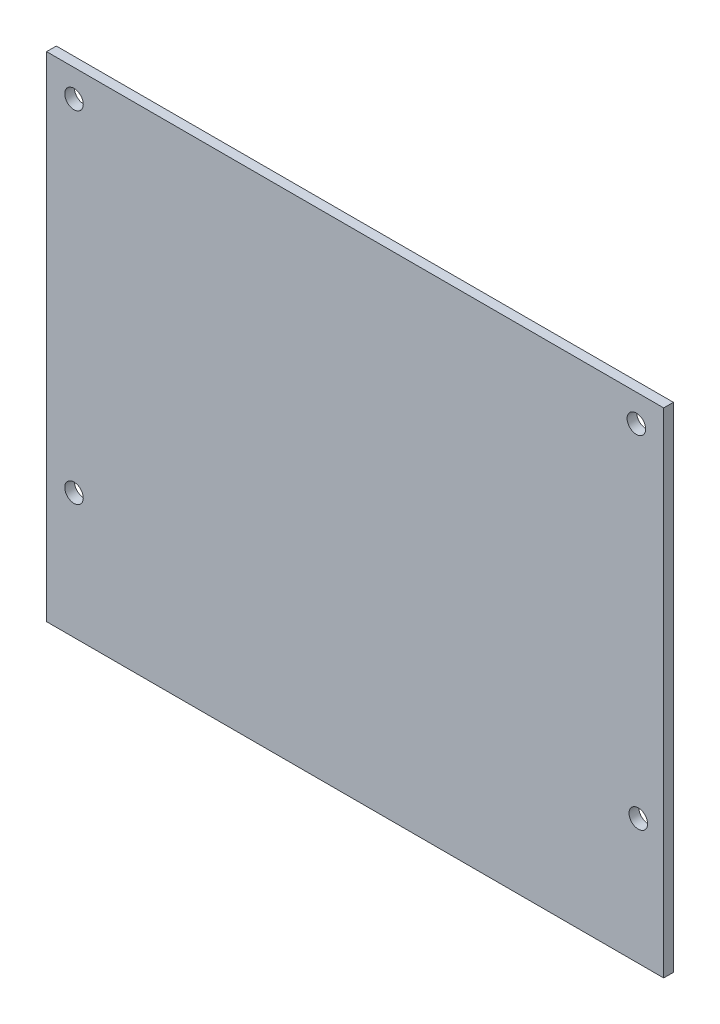
from build123d import *

# Parameters (mm, degrees)
MODEL_W             = 100.0000032
MODEL_H             = 79.9999924
BOSS_EXTRUDE1_DEPTH = 1.5748
SKETCH1_R           = 1.499997
CUT_EXTRUDE1_DEPTH  = 129.072164888


with BuildPart() as part:
    # Model → Boss-Extrude1 (new body)
    with BuildSketch(Plane.XY):
        with Locations((50.0000016, 39.9999962)):
            Rectangle(MODEL_W, MODEL_H)
    extrude(amount=-BOSS_EXTRUDE1_DEPTH)

    # Sketch1 → Cut-Extrude1 (cut, through all)
    with BuildSketch(Plane.XY):
        with Locations((95.885, 20.32)):
            Circle(SKETCH1_R)
        with Locations((95.5675, 75.565)):
            Circle(SKETCH1_R)
        with Locations((4.445, 75.565)):
            Circle(SKETCH1_R)
        with Locations((4.445, 20.32)):
            Circle(SKETCH1_R)
    extrude(amount=-CUT_EXTRUDE1_DEPTH, mode=Mode.SUBTRACT)


solid = part.part
